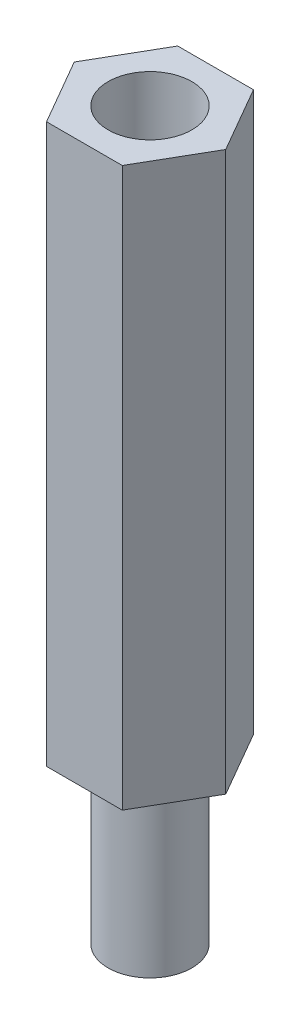
from build123d import *

# Parameters (mm, degrees)
SKETCH_1_R      = 1.5
EXTRUDE_1_DEPTH = 20
SKETCH_2_R      = 1.5
EXTRUDE_2_DEPTH = 6


with BuildPart() as part:
    # 草图1 → 凸台-拉伸1 (new body)
    with BuildSketch(Plane(origin=(0, 0, 0), x_dir=(1, 0, 0), z_dir=(0, 1, 0))):
        Polygon((2.713546265, 0), (1.356773133, 2.35), (-1.356773133, 2.35), (-2.713546265, 0), (-1.356773133, -2.35), (1.356773133, -2.35), align=None)
        with Locations(Location((0, 0, 0), (0, 0, 270))):
            Circle(SKETCH_1_R, mode=Mode.SUBTRACT)
    extrude(amount=EXTRUDE_1_DEPTH)


with BuildPart() as body_2:
    # 草图2 → 凸台-拉伸2 (new body)
    with BuildSketch(Plane(origin=(0, 0, 0), x_dir=(-1, 0, 0), z_dir=(0, -1, 0))):
        with Locations(Location((0, 0, 0), (0, 0, 90))):
            Circle(SKETCH_2_R)
    extrude(amount=EXTRUDE_2_DEPTH)


solid = Compound([part.part, body_2.part])
